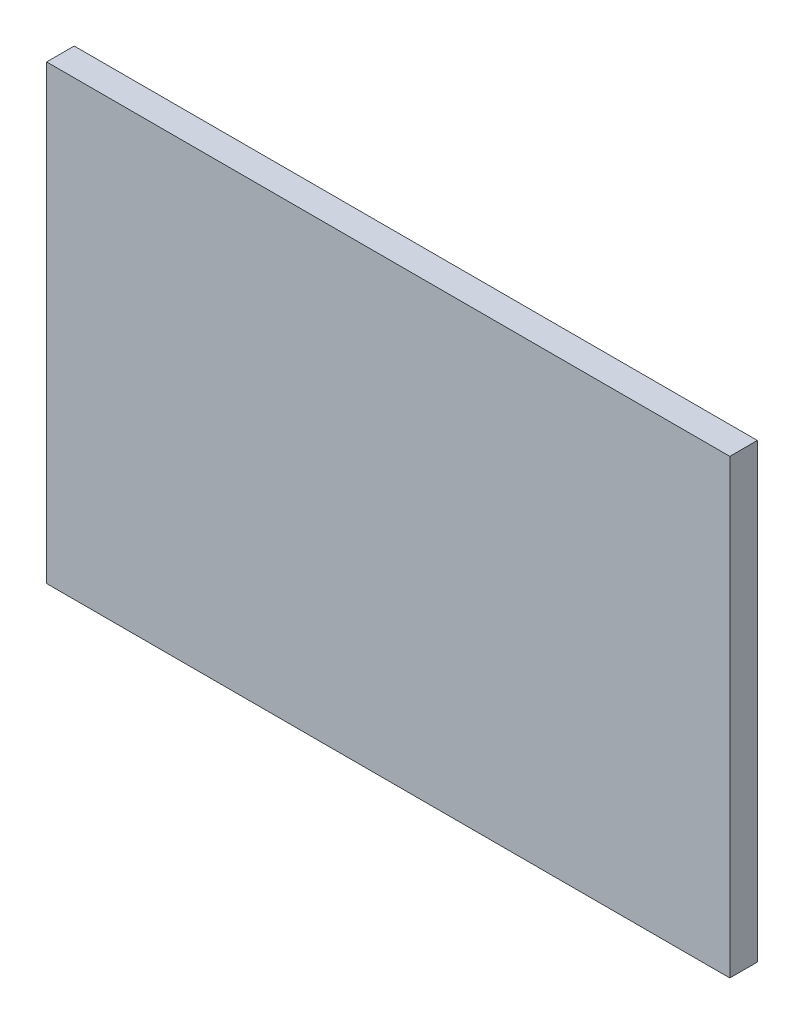
from build123d import *

# Parameters (mm, degrees)
SKETCH1_W           = 124
SKETCH1_H           = 82
BOSS_EXTRUDE1_DEPTH = 5


with BuildPart() as part:
    # Sketch1 → Boss-Extrude1 (new body)
    with BuildSketch(Plane.XY):
        Rectangle(SKETCH1_W, SKETCH1_H)
    extrude(amount=BOSS_EXTRUDE1_DEPTH)


solid = part.part
